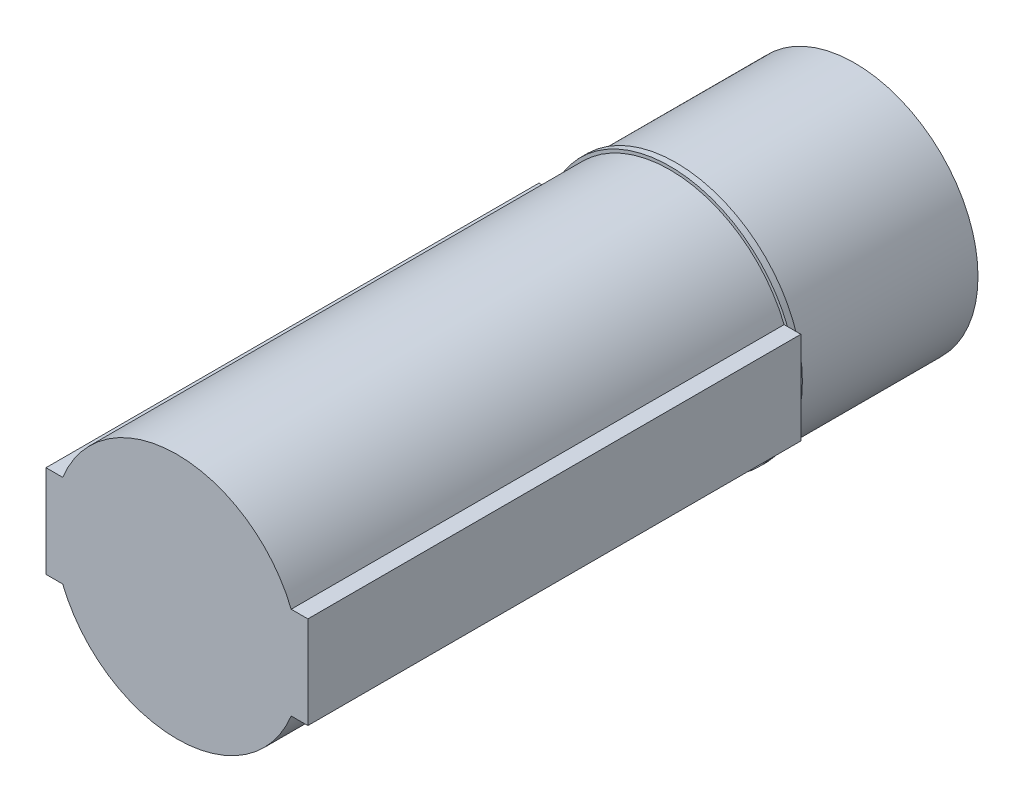
from build123d import *
from build123d.topology import SkipClean

# Parameters (mm, degrees)
SKETCH1_R           = 2
BOSS_EXTRUDE1_DEPTH = 7
SKETCH2_R           = 2.05
SKETCH2_R_2         = 2
BOSS_EXTRUDE3_DEPTH = 3
SKETCH3_R           = 2.05
SKETCH3_R_2         = 2
CUT_EXTRUDE1_DEPTH  = 2.9
BOSS_EXTRUDE4_DEPTH = 4
BOSS_EXTRUDE5_START = -8
BOSS_EXTRUDE5_DEPTH = 8


with BuildPart() as part:
    # Sketch1 → Boss-Extrude1 (new body)
    with BuildSketch(Plane.XY):
        Circle(SKETCH1_R)
        with BuildLine():
            Line((0.997797575, 1.12), (0.997797575, -1.12))
            ThreePointArc((0.997797575, -1.12), (-1.5, 0), (0.997797575, 1.12))
        make_face(mode=Mode.SUBTRACT)
    extrude(amount=BOSS_EXTRUDE1_DEPTH)

    # Sketch2 → Boss-Extrude3 (add)
    with BuildSketch(Plane.XY):
        Circle(SKETCH2_R)
        Circle(SKETCH2_R_2, mode=Mode.SUBTRACT)
    extrude(amount=BOSS_EXTRUDE3_DEPTH)

    # Sketch3 → Cut-Extrude1 (cut)
    with BuildSketch(Plane.XY):
        Circle(SKETCH3_R)
        Circle(SKETCH3_R_2, mode=Mode.SUBTRACT)
    extrude(amount=CUT_EXTRUDE1_DEPTH, mode=Mode.SUBTRACT)

    # Sketch4 → Boss-Extrude4 (add)
    with SkipClean():  # the faces are left unmerged after this step: merging them gives an invalid solid
        with BuildSketch(Plane.XY.offset(7)):
            with BuildLine():
                Line((1.854049622, 0.75), (2.125, 0.75))
                Line((2.125, 0.75), (2.125, -0.75))
                Line((2.125, -0.75), (1.854049622, -0.75))
                ThreePointArc((1.854049622, -0.75), (0, -2), (-1.854049622, -0.75))
                Line((-1.854049622, -0.75), (-2.125, -0.75))
                Line((-2.125, -0.75), (-2.125, 0.75))
                Line((-2.125, 0.75), (-1.854049622, 0.75))
                ThreePointArc((-1.854049622, 0.75), (0, 2), (1.854049622, 0.75))
            make_face()
        extrude(amount=BOSS_EXTRUDE4_DEPTH)

    # Sketch8 → Boss-Extrude5 (add)
    with BuildSketch(Plane.XY.offset(11).offset(BOSS_EXTRUDE5_START)):
        with BuildLine():
            Line((1.854049622, -0.75), (2.125, -0.75))
            Line((2.125, -0.75), (2.125, 0.75))
            Line((2.125, 0.75), (1.854049622, 0.75))
            ThreePointArc((1.854049622, 0.75), (2, 0), (1.854049622, -0.75))
        make_face()
        with BuildLine():
            Line((-2.125, -0.75), (-1.854049622, -0.75))
            ThreePointArc((-1.854049622, -0.75), (-2, 0), (-1.854049622, 0.75))
            Line((-1.854049622, 0.75), (-2.125, 0.75))
            Line((-2.125, 0.75), (-2.125, -0.75))
        make_face()
    extrude(amount=BOSS_EXTRUDE5_DEPTH)


solid = part.part
